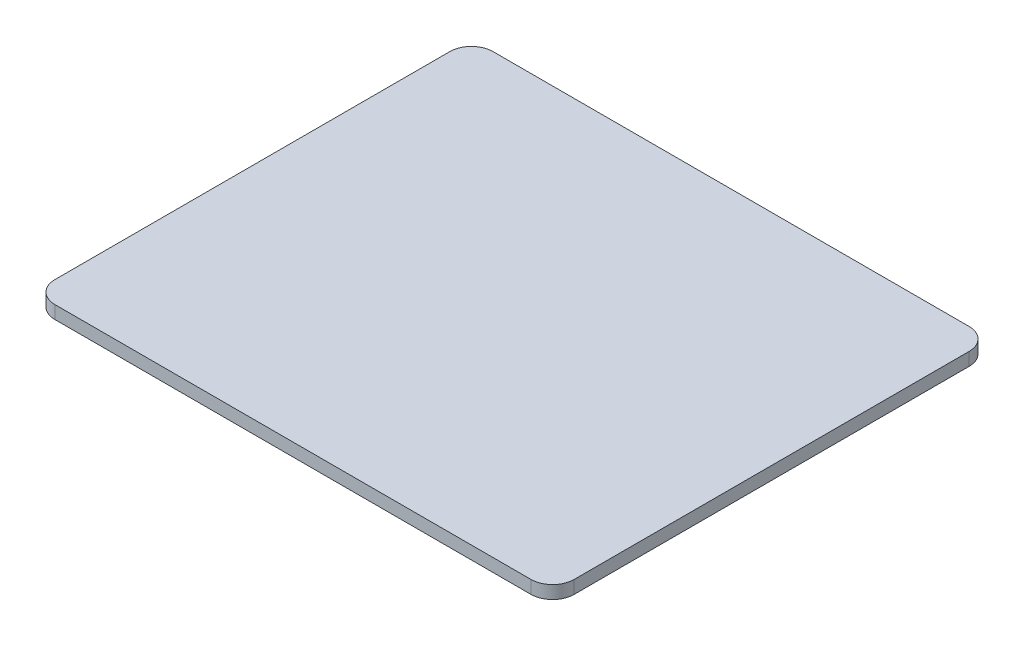
from build123d import *

# Parameters (mm, degrees)
SKETCH1_W           = 120
SKETCH1_H           = 101.25
BOSS_EXTRUDE1_DEPTH = 3
FILLET1_R           = 5


with BuildPart() as part:
    # Sketch1 → Boss-Extrude1 (new body)
    with BuildSketch(Plane(origin=(0, 0, 0), x_dir=(1, 0, 0), z_dir=(0, 1, 0))):
        Rectangle(SKETCH1_W, SKETCH1_H)
    extrude(amount=BOSS_EXTRUDE1_DEPTH)

    # Fillet1
    fillet1_edges = [part.edges().sort_by_distance(p)[0] for p in [
        (60, 1.5, 50.625),
        (-60, 1.5, 50.625),
        (-60, 1.5, -50.625),
        (60, 1.5, -50.625),
    ]]
    fillet(fillet1_edges, radius=FILLET1_R)


solid = part.part
